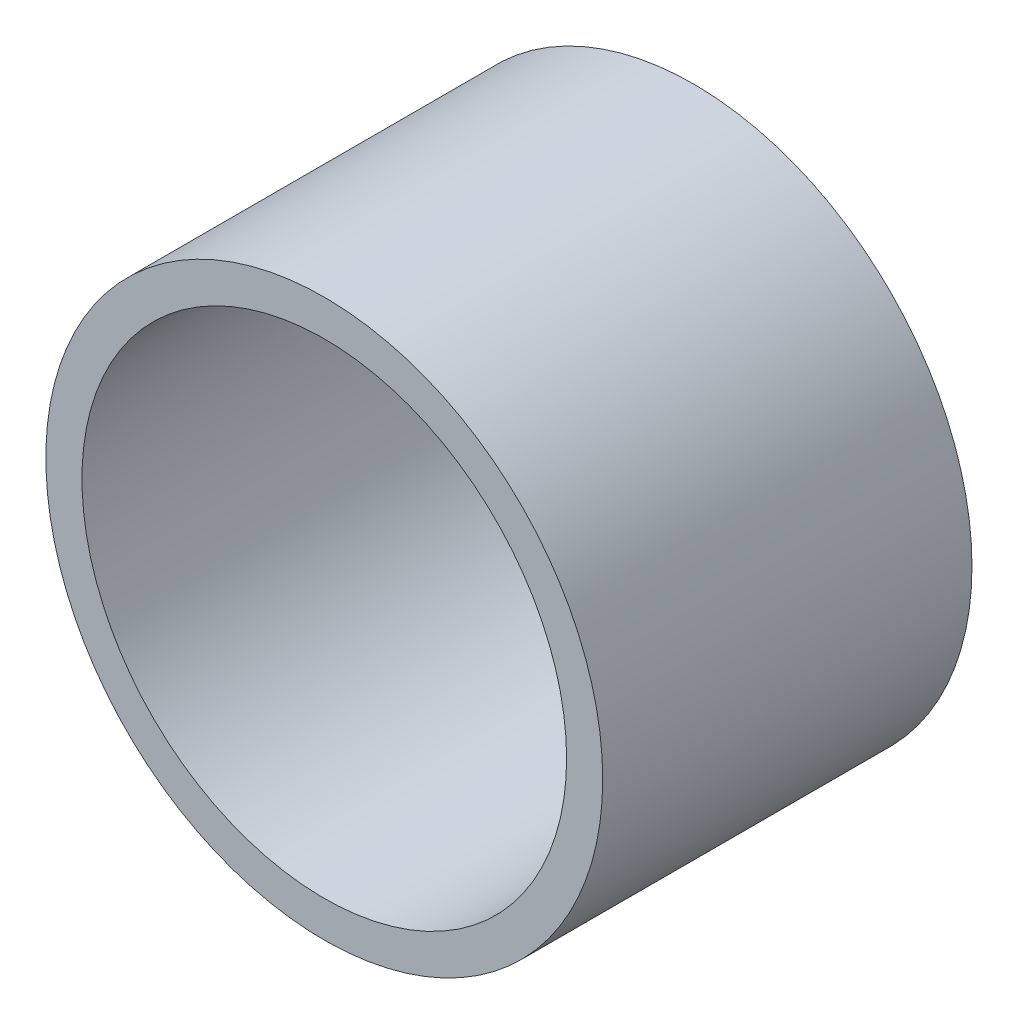
from build123d import *

# Parameters (mm, degrees)
SKETCH1_R           = 30.1625
SKETCH1_R_2         = 26.2509
EXTRUDE_THIN1_DEPTH = 20


with BuildPart() as part:
    # Sketch1 → Extrude-Thin1 (new, symmetric)
    with BuildSketch(Plane.XY):
        Circle(SKETCH1_R)
        Circle(SKETCH1_R_2, mode=Mode.SUBTRACT)
    extrude(amount=EXTRUDE_THIN1_DEPTH, both=True)


solid = part.part
